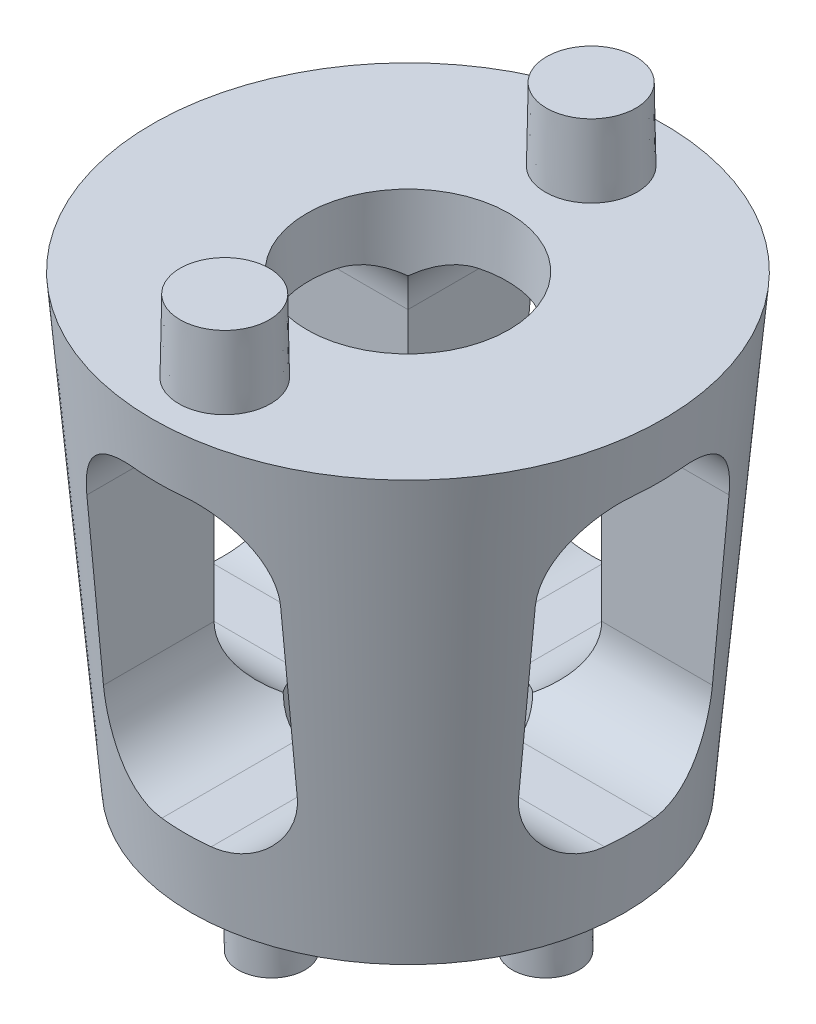
from build123d import *

# Parameters (mm, degrees)
SKETCH_1_R                = 15.004
EXTRUDE_1_DEPTH           = 31
EXTRUDE_1_DRAFT           = -5
SKETCH_5_R                = 3.18
EXTRUDE_4_DEPTH           = 5
EXTRUDE_4_DRAFT           = 1
EXTRUDE_4_PROFILE_2_DEPTH = 5
EXTRUDE_4_PROFILE_2_DRAFT = 1
EXTRUDE_4_PROFILE_3_DEPTH = 5
EXTRUDE_4_PROFILE_3_DRAFT = 1
EXTRUDE_4_PROFILE_4_DEPTH = 5
EXTRUDE_4_PROFILE_4_DRAFT = 1
SKETCH_6_R                = 2.4
EXTRUDE_5_DEPTH           = 5
EXTRUDE_5_DRAFT           = 1
EXTRUDE_5_PROFILE_2_DEPTH = 5
EXTRUDE_5_PROFILE_2_DRAFT = 1
EXTRUDE_5_PROFILE_3_DEPTH = 5
EXTRUDE_5_PROFILE_3_DRAFT = 1
EXTRUDE_5_PROFILE_4_DEPTH = 5
EXTRUDE_5_PROFILE_4_DRAFT = 1
SKETCH_7_R                = 7
CUT_EXTRUDE_2_DEPTH       = 40
CUT_EXTRUDE_2_DRAFT       = -2
CUT_EXTRUDE_3_DEPTH       = 20
PATTERN_CIRCULAR_1_COUNT  = 4
SKETCH_9_W                = 8.613573306
SKETCH_9_H                = 9.235663681
CUT_EXTRUDE_4_DEPTH       = 25


with BuildPart() as part:
    # 草图1 → 凸台-拉伸1 (with draft: the straight prism first)
    with BuildSketch(Plane(origin=(0, 0, 0), x_dir=(1, 0, 0), z_dir=(0, 1, 0))):
        Circle(SKETCH_1_R)
    extrude(amount=EXTRUDE_1_DEPTH)
    # 凸台-拉伸1: the draft: its side faces are tilted about the plane it starts from
    extrude_1_sides = [part.faces().sort_by_distance(p)[0] for p in [
        (-15.004, 15.5, 0),
    ]]
    draft(extrude_1_sides, Plane(origin=(0, 0, 0), x_dir=(1, 0, 0), z_dir=(0, 1, 0)), EXTRUDE_1_DRAFT)


with BuildPart() as extrude_4_tool:
    # 草图5 → 凸台-拉伸4 (with draft: the straight prism first)
    with BuildSketch(Plane(origin=(0, 31, 0), x_dir=(1, 0, 0), z_dir=(0, 1, 0))):
        with Locations((-12.7, 0)):
            Circle(SKETCH_5_R)
    extrude(amount=EXTRUDE_4_DEPTH)
    # 凸台-拉伸4: the draft: its side faces are tilted about the plane it starts from
    extrude_4_sides = [extrude_4_tool.faces().sort_by_distance(p)[0] for p in [
        (-15.88, 33.5, 0),
    ]]
    draft(extrude_4_sides, Plane(origin=(0, 31, 0), x_dir=(1, 0, 0), z_dir=(0, 1, 0)), EXTRUDE_4_DRAFT)


with BuildPart() as part_1:
    add(part.part)

    # 凸台-拉伸4: add extrude_4_tool
    add(extrude_4_tool.part)


with BuildPart() as extrude_4_profile_2_tool:
    # 草图5 → 凸台-拉伸4 profile 2 (with draft: the straight prism first)
    with BuildSketch(Plane(origin=(0, 31, 0), x_dir=(1, 0, 0), z_dir=(0, 1, 0))):
        with Locations((0, 12.7)):
            Circle(SKETCH_5_R)
    extrude(amount=EXTRUDE_4_PROFILE_2_DEPTH)
    # 凸台-拉伸4 profile 2: the draft: its side faces are tilted about the plane it starts from
    extrude_4_profile_2_sides = [extrude_4_profile_2_tool.faces().sort_by_distance(p)[0] for p in [
        (-3.18, 33.5, -12.7),
    ]]
    draft(extrude_4_profile_2_sides, Plane(origin=(0, 31, 0), x_dir=(1, 0, 0), z_dir=(0, 1, 0)), EXTRUDE_4_PROFILE_2_DRAFT)


with BuildPart() as part_2:
    add(part_1.part)

    # 凸台-拉伸4 profile 2: add extrude_4_profile_2_tool
    add(extrude_4_profile_2_tool.part)


with BuildPart() as extrude_4_profile_3_tool:
    # 草图5 → 凸台-拉伸4 profile 3 (with draft: the straight prism first)
    with BuildSketch(Plane(origin=(0, 31, 0), x_dir=(1, 0, 0), z_dir=(0, 1, 0))):
        with Locations((12.7, 0)):
            Circle(SKETCH_5_R)
    extrude(amount=EXTRUDE_4_PROFILE_3_DEPTH)
    # 凸台-拉伸4 profile 3: the draft: its side faces are tilted about the plane it starts from
    extrude_4_profile_3_sides = [extrude_4_profile_3_tool.faces().sort_by_distance(p)[0] for p in [
        (9.52, 33.5, 0),
    ]]
    draft(extrude_4_profile_3_sides, Plane(origin=(0, 31, 0), x_dir=(1, 0, 0), z_dir=(0, 1, 0)), EXTRUDE_4_PROFILE_3_DRAFT)


with BuildPart() as part_3:
    add(part_2.part)

    # 凸台-拉伸4 profile 3: add extrude_4_profile_3_tool
    add(extrude_4_profile_3_tool.part)


with BuildPart() as extrude_4_profile_4_tool:
    # 草图5 → 凸台-拉伸4 profile 4 (with draft: the straight prism first)
    with BuildSketch(Plane(origin=(0, 31, 0), x_dir=(1, 0, 0), z_dir=(0, 1, 0))):
        with Locations((0, -12.7)):
            Circle(SKETCH_5_R)
    extrude(amount=EXTRUDE_4_PROFILE_4_DEPTH)
    # 凸台-拉伸4 profile 4: the draft: its side faces are tilted about the plane it starts from
    extrude_4_profile_4_sides = [extrude_4_profile_4_tool.faces().sort_by_distance(p)[0] for p in [
        (-3.18, 33.5, 12.7),
    ]]
    draft(extrude_4_profile_4_sides, Plane(origin=(0, 31, 0), x_dir=(1, 0, 0), z_dir=(0, 1, 0)), EXTRUDE_4_PROFILE_4_DRAFT)


with BuildPart() as part_4:
    add(part_3.part)

    # 凸台-拉伸4 profile 4: add extrude_4_profile_4_tool
    add(extrude_4_profile_4_tool.part)


with BuildPart() as extrude_5_tool:
    # 草图6 → 凸台-拉伸5 (with draft: the straight prism first)
    with BuildSketch(Plane.XZ):
        with Locations((-9.452363164, 0)):
            Circle(SKETCH_6_R)
    extrude(amount=EXTRUDE_5_DEPTH)
    # 凸台-拉伸5: the draft: its side faces are tilted about the plane it starts from
    extrude_5_sides = [extrude_5_tool.faces().sort_by_distance(p)[0] for p in [
        (-11.852363164, -2.5, 0),
    ]]
    draft(extrude_5_sides, Plane.XZ, EXTRUDE_5_DRAFT)


with BuildPart() as part_5:
    add(part_4.part)

    # 凸台-拉伸5: add extrude_5_tool
    add(extrude_5_tool.part)


with BuildPart() as extrude_5_profile_2_tool:
    # 草图6 → 凸台-拉伸5 profile 2 (with draft: the straight prism first)
    with BuildSketch(Plane.XZ):
        with Locations((0.047636836, 9.5)):
            Circle(SKETCH_6_R)
    extrude(amount=EXTRUDE_5_PROFILE_2_DEPTH)
    # 凸台-拉伸5 profile 2: the draft: its side faces are tilted about the plane it starts from
    extrude_5_profile_2_sides = [extrude_5_profile_2_tool.faces().sort_by_distance(p)[0] for p in [
        (-2.352363164, -2.5, 9.5),
    ]]
    draft(extrude_5_profile_2_sides, Plane.XZ, EXTRUDE_5_PROFILE_2_DRAFT)


with BuildPart() as part_6:
    add(part_5.part)

    # 凸台-拉伸5 profile 2: add extrude_5_profile_2_tool
    add(extrude_5_profile_2_tool.part)


with BuildPart() as extrude_5_profile_3_tool:
    # 草图6 → 凸台-拉伸5 profile 3 (with draft: the straight prism first)
    with BuildSketch(Plane.XZ):
        with Locations((9.547636836, 0)):
            Circle(SKETCH_6_R)
    extrude(amount=EXTRUDE_5_PROFILE_3_DEPTH)
    # 凸台-拉伸5 profile 3: the draft: its side faces are tilted about the plane it starts from
    extrude_5_profile_3_sides = [extrude_5_profile_3_tool.faces().sort_by_distance(p)[0] for p in [
        (7.147636836, -2.5, 0),
    ]]
    draft(extrude_5_profile_3_sides, Plane.XZ, EXTRUDE_5_PROFILE_3_DRAFT)


with BuildPart() as part_7:
    add(part_6.part)

    # 凸台-拉伸5 profile 3: add extrude_5_profile_3_tool
    add(extrude_5_profile_3_tool.part)


with BuildPart() as extrude_5_profile_4_tool:
    # 草图6 → 凸台-拉伸5 profile 4 (with draft: the straight prism first)
    with BuildSketch(Plane.XZ):
        with Locations((0.047636836, -9.5)):
            Circle(SKETCH_6_R)
    extrude(amount=EXTRUDE_5_PROFILE_4_DEPTH)
    # 凸台-拉伸5 profile 4: the draft: its side faces are tilted about the plane it starts from
    extrude_5_profile_4_sides = [extrude_5_profile_4_tool.faces().sort_by_distance(p)[0] for p in [
        (-2.352363164, -2.5, -9.5),
    ]]
    draft(extrude_5_profile_4_sides, Plane.XZ, EXTRUDE_5_PROFILE_4_DRAFT)


with BuildPart() as part_8:
    add(part_7.part)

    # 凸台-拉伸5 profile 4: add extrude_5_profile_4_tool
    add(extrude_5_profile_4_tool.part)


with BuildPart() as cut_extrude_2_tool:
    # 草图7 → 切除-拉伸2 (with draft: the straight prism first)
    with BuildSketch(Plane(origin=(0, 31, 0), x_dir=(1, 0, 0), z_dir=(0, 1, 0))):
        Circle(SKETCH_7_R)
    extrude(amount=-CUT_EXTRUDE_2_DEPTH)
    # 切除-拉伸2: the draft: its side faces are tilted about the plane it starts from
    cut_extrude_2_sides = [cut_extrude_2_tool.faces().sort_by_distance(p)[0] for p in [
        (-7, 11, 0),
    ]]
    draft(cut_extrude_2_sides, Plane(origin=(0, 31, 0), x_dir=(1, 0, 0), z_dir=(0, 1, 0)), CUT_EXTRUDE_2_DRAFT)


with BuildPart() as part_9:
    add(part_8.part)

    # 切除-拉伸2: cut by cut_extrude_2_tool
    add(cut_extrude_2_tool.part, mode=Mode.SUBTRACT)

    # 草图8 → 切除-拉伸3 (cut, symmetric)
    with BuildSketch(Plane(origin=(0, 0, 0), x_dir=(0, 0, -1), z_dir=(1, 0, 0))):
        with BuildLine():
            Line((-1.716148569, 27), (1.716148569, 27))
            ThreePointArc((1.716148569, 27), (5.251682475, 25.535533906), (6.716148569, 22))
            Line((6.716148569, 22), (6.716148569, 10))
            ThreePointArc((6.716148569, 10), (5.251682475, 6.464466094), (1.716148569, 5))
            Line((1.716148569, 5), (-1.716148569, 5))
            ThreePointArc((-1.716148569, 5), (-5.251682475, 6.464466094), (-6.716148569, 10))
            Line((-6.716148569, 10), (-6.716148569, 22))
            ThreePointArc((-6.716148569, 22), (-5.251682475, 25.535533906), (-1.716148569, 27))
        make_face()
    cut_extrude_3 = extrude(amount=CUT_EXTRUDE_3_DEPTH, both=True, mode=Mode.SUBTRACT)

    # 阵列(圆周)1: 切除-拉伸3 ×4 about axis
    pattern_circular_1_axis = Axis((0, 0, 0), (0, 1, 0))
    for i in range(1, PATTERN_CIRCULAR_1_COUNT):
        add(cut_extrude_3.rotate(pattern_circular_1_axis, i * 360 / PATTERN_CIRCULAR_1_COUNT), mode=Mode.SUBTRACT)

    # 草图9 → 切除-拉伸4 (cut, symmetric)
    with BuildSketch(Plane(origin=(0, 0, 0), x_dir=(0, 0, -1), z_dir=(1, 0, 0))):
        with Locations((0.18638275, 35.617831841)):
            Rectangle(SKETCH_9_W, SKETCH_9_H)
    extrude(amount=CUT_EXTRUDE_4_DEPTH, both=True, mode=Mode.SUBTRACT)


solid = part_9.part
